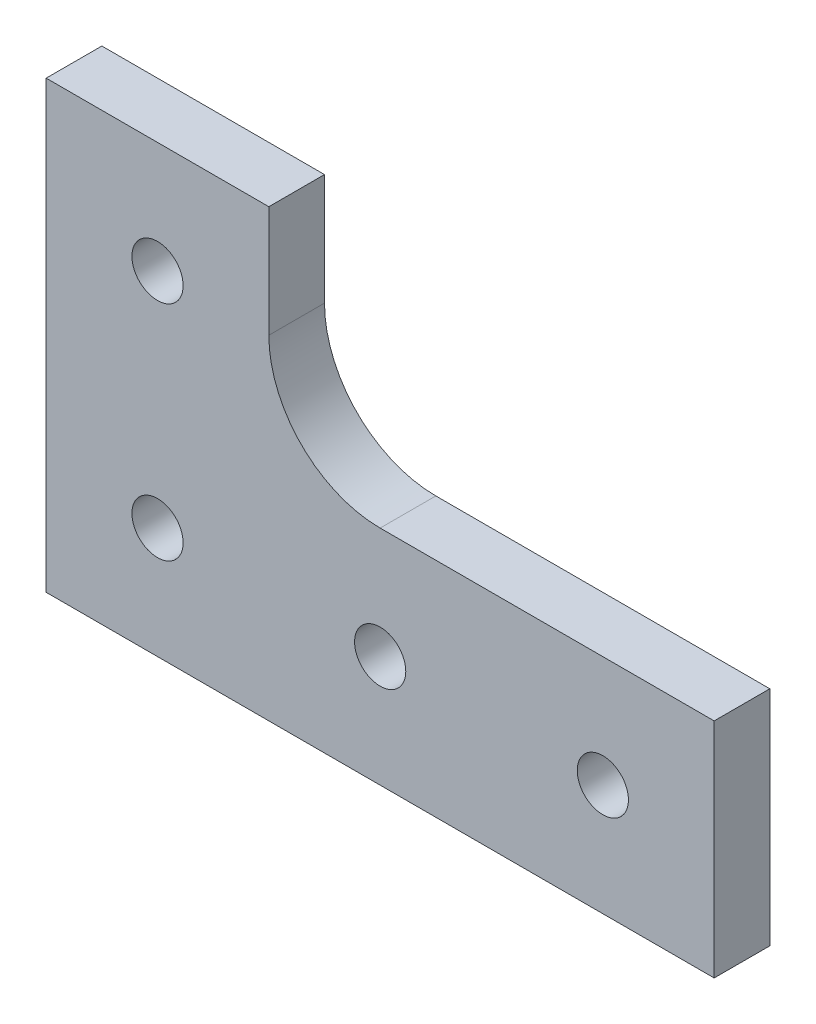
from build123d import *

# Parameters (mm, degrees)
BOSS_EXTRUDE1_DEPTH = 6.35
SKETCH2_R           = 2.921
CUT_EXTRUDE1_DEPTH  = 92.800885072
FILLET1_R           = 12.7


with BuildPart() as part:
    # Sketch1 → Boss-Extrude1 (new body)
    with BuildSketch(Plane.XY):
        Polygon((0, 0), (0, 50.8), (25.4, 50.8), (25.4, 25.4), (76.2, 25.4), (76.2, 0), align=None)
    extrude(amount=BOSS_EXTRUDE1_DEPTH)

    # Sketch2 → Cut-Extrude1 (cut, through all)
    with BuildSketch(Plane.XY.offset(6.35)):
        with Locations((12.7, 38.1)):
            Circle(SKETCH2_R)
        with Locations((12.7, 12.7)):
            Circle(SKETCH2_R)
        with Locations((38.1, 12.7)):
            Circle(SKETCH2_R)
        with Locations((63.5, 12.7)):
            Circle(SKETCH2_R)
    extrude(amount=-CUT_EXTRUDE1_DEPTH, mode=Mode.SUBTRACT)

    # Fillet1
    fillet1_edges = [part.edges().sort_by_distance(p)[0] for p in [
        (25.4, 25.4, 3.175),
    ]]
    fillet(fillet1_edges, radius=FILLET1_R)


solid = part.part
